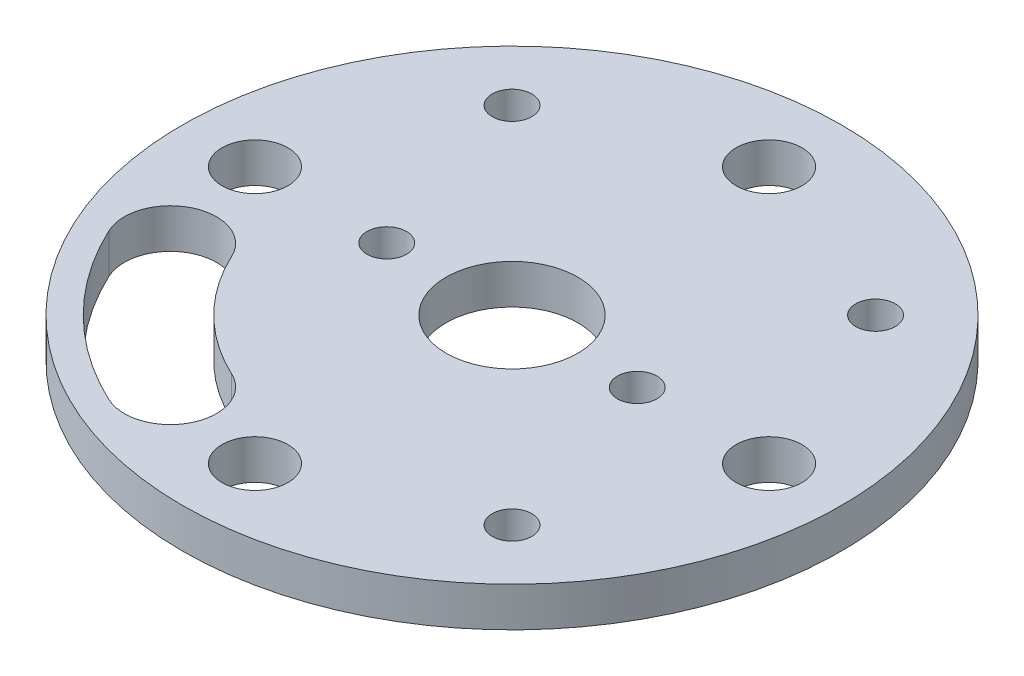
from build123d import *

# Parameters (mm, degrees)
SKETCH_1_R      = 25
SKETCH_1_R_2    = 5
SKETCH_1_R_3    = 1.5
SKETCH_1_R_4    = 2.5
EXTRUDE_1_DEPTH = 3


with BuildPart() as part:
    # 草圖1 → 填料-伸長1 (new body)
    with BuildSketch(Plane(origin=(0, 0, 0), x_dir=(1, 0, 0), z_dir=(0, 1, 0))):
        with Locations(Location((0, 0, 0), (0, 0, 270))):
            Circle(SKETCH_1_R)
        with Locations(Location((0, 0, 0), (0, 0, 270))):
            Circle(SKETCH_1_R_2, mode=Mode.SUBTRACT)
        with Locations(Location((-9.5, 0, 0), (0, 0, 270))):
            Circle(SKETCH_1_R_3, mode=Mode.SUBTRACT)
        with Locations(Location((9.5, 0, 0), (0, 0, 270))):
            Circle(SKETCH_1_R_3, mode=Mode.SUBTRACT)
        with Locations(Location((0, 19.5, 0), (0, 0, 270))):
            Circle(SKETCH_1_R_4, mode=Mode.SUBTRACT)
        with Locations(Location((19.5, 0, 0), (0, 0, 270))):
            Circle(SKETCH_1_R_4, mode=Mode.SUBTRACT)
        with Locations(Location((0, -19.5, 0), (0, 0, 270))):
            Circle(SKETCH_1_R_4, mode=Mode.SUBTRACT)
        with Locations(Location((-19.5, 0, 0), (0, 0, 270))):
            Circle(SKETCH_1_R_4, mode=Mode.SUBTRACT)
        with Locations(Location((-13.788582233, 13.788582233, 0), (0, 0, 270))):
            Circle(SKETCH_1_R_3, mode=Mode.SUBTRACT)
        with Locations(Location((13.788582233, 13.788582233, 0), (0, 0, 270))):
            Circle(SKETCH_1_R_3, mode=Mode.SUBTRACT)
        with Locations(Location((13.788582233, -13.788582233, 0), (0, 0, 270))):
            Circle(SKETCH_1_R_3, mode=Mode.SUBTRACT)
        with BuildLine():
            ThreePointArc((-20.845079102, -9.72022002), (-16.263455967, -16.263455967), (-9.72022002, -20.845079102))
            ThreePointArc((-9.72022002, -20.845079102), (-5.068978849, -19.152165763), (-6.761892188, -14.500924593))
            ThreePointArc((-6.761892188, -14.500924593), (-11.313708499, -11.313708499), (-14.500924593, -6.761892188))
            ThreePointArc((-14.500924593, -6.761892188), (-19.152165763, -5.068978849), (-20.845079102, -9.72022002))
        make_face(mode=Mode.SUBTRACT)
    extrude(amount=EXTRUDE_1_DEPTH)


solid = part.part
